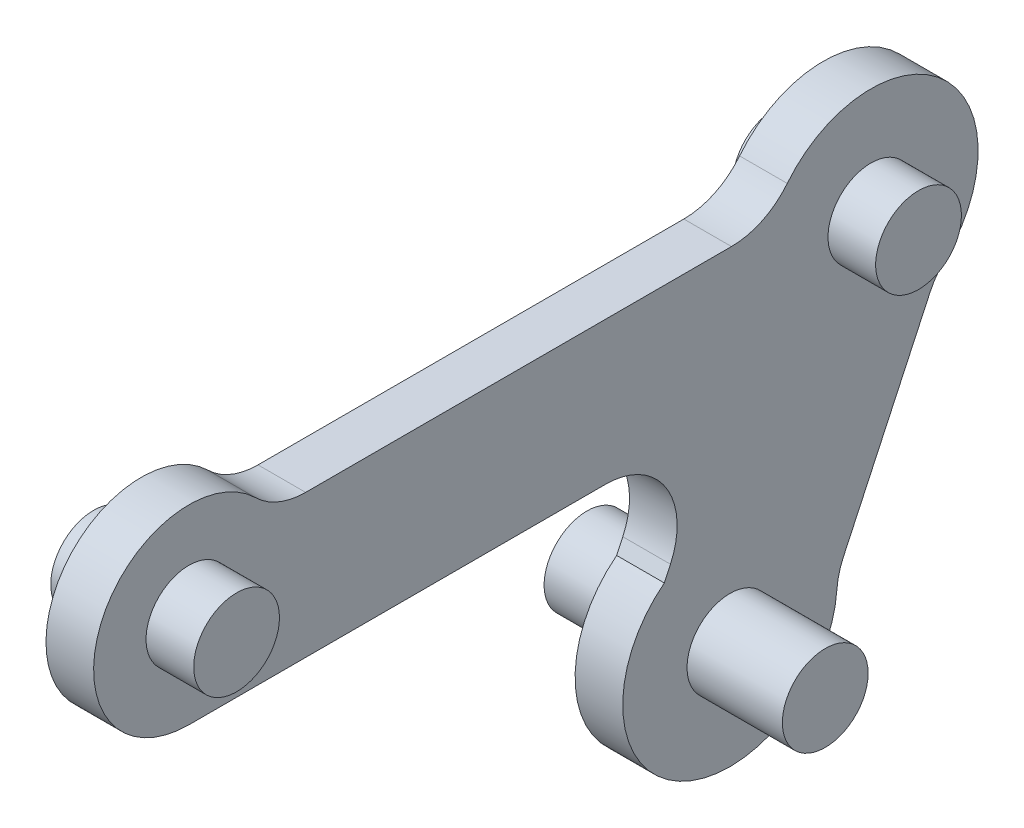
from build123d import *

# Parameters (mm, degrees)
EXTRUDE_1_DEPTH     = 2
SKETCH_1_3_R        = 2
CUT_EXTRUDE_1_DEPTH = 35.66133887
FILLET_1_R          = 3
EXTRUDE_START       = -2
SKETCH_2_R          = 2
EXTRUDE_2_DEPTH     = 2
SKETCH_2_5_R        = 1.8
EXTRUDE_5_DEPTH     = 2
EXTRUDE_START_2     = -4
SKETCH_2_6_R        = 1.8
EXTRUDE_6_DEPTH     = 2
SKETCH_2_7_R        = 1.8
EXTRUDE_7_DEPTH     = 4
EXTRUDE_START_3     = -6
SKETCH_2_8_R        = 1.8
EXTRUDE_8_DEPTH     = 4


with BuildPart() as part:
    # 草图1 → 凸台-拉伸1 (new body)
    with BuildSketch(Plane(origin=(0, 0, 0), x_dir=(0, 0, -1), z_dir=(1, 0, 0))):
        with BuildLine():
            Line((-25, -6), (-25, 0))
            Line((-25, 0), (-21.535898385, 0))
            ThreePointArc((-21.535898385, 0), (-28.464101615, 0), (-25, -6))
        make_face()
        with BuildLine():
            Line((-21.535898385, 0), (-25, 0))
            Line((-25, 0), (-25, -6))
            ThreePointArc((-25, -6), (-22.171572875, -4.828427125), (-21, -2))
            ThreePointArc((-21, -2), (-21.136296695, -0.96472382), (-21.535898385, 0))
        make_face()
        with BuildLine():
            Line((-0.545176611, 0), (-21.535898385, 0))
            ThreePointArc((-21.535898385, 0), (-21.136296695, -0.96472382), (-21, -2))
            ThreePointArc((-21, -2), (-22.171572875, -4.828427125), (-25, -6))
            Line((-25, -6), (-2.797845949, -6))
            Line((-2.797845949, -6), (-0.871249866, -1.868401368))
            ThreePointArc((-0.871249866, -1.868401368), (-0.807766841, -0.916826597), (-0.545176611, 0))
        make_face()
        with BuildLine():
            ThreePointArc((8.125231148, -1.690473047), (4.486383017, 2.726360373), (-0.545176611, 0))
            Line((-0.545176611, 0), (0, 0))
            Line((0, 0), (7.250462296, -3.380946094))
            Line((7.250462296, -3.380946094), (6.37921243, -5.249347462))
            ThreePointArc((6.37921243, -5.249347462), (7.66521356, -3.67252807), (8.125231148, -1.690473047))
        make_face()
        with BuildLine():
            Line((0, 0), (-0.545176611, 0))
            ThreePointArc((-0.545176611, 0), (-0.807766841, -0.916826597), (-0.871249866, -1.868401368))
            Line((-0.871249866, -1.868401368), (0, 0))
        make_face()
        with BuildLine():
            Line((-0.871249866, -1.868401368), (-2.797845949, -6))
            Line((-2.797845949, -6), (0, -6))
            Line((0, -6), (0, -4.356499889))
            ThreePointArc((0, -4.356499889), (-0.621910323, -3.177681615), (-0.871249866, -1.868401368))
        make_face()
        with BuildLine():
            Line((0, -6), (-2.797845949, -6))
            Line((-2.797845949, -6), (-5.045405798, -10.819907651))
            ThreePointArc((-5.045405798, -10.819907651), (-0.389642338, -10.300397024), (2.205056498, -14.200853745))
            Line((2.205056498, -14.200853745), (6.37921243, -5.249347462))
            ThreePointArc((6.37921243, -5.249347462), (3.001481776, -6.147034134), (0, -4.356499889))
            Line((0, -4.356499889), (0, -6))
        make_face()
        with BuildLine():
            Line((7.250462296, -3.380946094), (0, 0))
            Line((0, 0), (0, -4.356499889))
            ThreePointArc((0, -4.356499889), (3.001481776, -6.147034134), (6.37921243, -5.249347462))
            Line((6.37921243, -5.249347462), (7.250462296, -3.380946094))
        make_face()
        with BuildLine():
            Line((0, -4.356499889), (0, 0))
            Line((0, 0), (-0.871249866, -1.868401368))
            ThreePointArc((-0.871249866, -1.868401368), (-0.621910323, -3.177681615), (0, -4.356499889))
        make_face()
        with BuildLine():
            ThreePointArc((2.205056498, -14.200853745), (-0.389642338, -10.300397024), (-5.045405798, -10.819907651))
            Line((-5.045405798, -10.819907651), (-5.916655664, -12.688309019))
            Line((-5.916655664, -12.688309019), (1.333806632, -16.069255112))
            Line((1.333806632, -16.069255112), (2.205056498, -14.200853745))
        make_face()
        with BuildLine():
            Line((-5.916655664, -12.688309019), (-5.045405798, -10.819907651))
            ThreePointArc((-5.045405798, -10.819907651), (-4.27347954, -18.418764477), (2.208575484, -14.378782065))
            ThreePointArc((2.208575484, -14.378782065), (2.207695651, -14.289800508), (2.205056498, -14.200853745))
            Line((2.205056498, -14.200853745), (1.333806632, -16.069255112))
            Line((1.333806632, -16.069255112), (-5.916655664, -12.688309019))
        make_face()
    extrude(amount=EXTRUDE_1_DEPTH)

    # 草图1<3> → 切除-拉伸1 (cut, through all)
    with BuildSketch(Plane(origin=(0, 0, 0), x_dir=(0, 0, -1), z_dir=(1, 0, 0))):
        with Locations((-25, -2)):
            Circle(SKETCH_1_3_R)
        with Locations((3.625231148, -1.690473047)):
            Circle(SKETCH_1_3_R)
        with Locations((-2.291424516, -14.378782065)):
            Circle(SKETCH_1_3_R)
    extrude(amount=CUT_EXTRUDE_1_DEPTH, mode=Mode.SUBTRACT)

    # 圆角1
    fillet_1_edges = [part.edges().sort_by_distance(p)[0] for p in [
        (1, -6, 2.797845949),
        (1, 0, 0.545176611),
        (1, -5.249347462, -6.37921243),
        (1, -14.200853745, -2.205056498),
        (1, 0, 21.535898385),
    ]]
    fillet(fillet_1_edges, radius=FILLET_1_R)

    # 草图2 → 凸台-拉伸2 (add)
    with BuildSketch(Plane(origin=(2, 0, 0), x_dir=(0, 0, -1), z_dir=(1, 0, 0)).offset(EXTRUDE_START)):
        with Locations((3.625231148, -1.690473047)):
            Circle(SKETCH_2_R)
        with Locations((-2.291424516, -14.378782065)):
            Circle(SKETCH_2_R)
        with Locations((-25, -2)):
            Circle(SKETCH_2_R)
    extrude(amount=EXTRUDE_2_DEPTH)

    # 草图2<5> → 凸台-拉伸5 (add)
    with BuildSketch(Plane(origin=(2, 0, 0), x_dir=(0, 0, -1), z_dir=(1, 0, 0))):
        with Locations((-25, -2)):
            Circle(SKETCH_2_5_R)
        with Locations((3.625231148, -1.690473047)):
            Circle(SKETCH_2_5_R)
    extrude(amount=EXTRUDE_5_DEPTH)

    # 草图2<6> → 凸台-拉伸6 (add)
    with BuildSketch(Plane(origin=(2, 0, 0), x_dir=(0, 0, -1), z_dir=(1, 0, 0)).offset(EXTRUDE_START_2)):
        with Locations((-25, -2)):
            Circle(SKETCH_2_6_R)
        with Locations((3.625231148, -1.690473047)):
            Circle(SKETCH_2_6_R)
    extrude(amount=EXTRUDE_6_DEPTH)

    # 草图2<7> → 凸台-拉伸7 (add)
    with BuildSketch(Plane(origin=(2, 0, 0), x_dir=(0, 0, -1), z_dir=(1, 0, 0))):
        with Locations((-2.291424516, -14.378782065)):
            Circle(SKETCH_2_7_R)
    extrude(amount=EXTRUDE_7_DEPTH)

    # 草图2<8> → 凸台-拉伸8 (add)
    with BuildSketch(Plane(origin=(2, 0, 0), x_dir=(0, 0, -1), z_dir=(1, 0, 0)).offset(EXTRUDE_START_3)):
        with Locations((-2.291424516, -14.378782065)):
            Circle(SKETCH_2_8_R)
    extrude(amount=EXTRUDE_8_DEPTH)


solid = part.part
